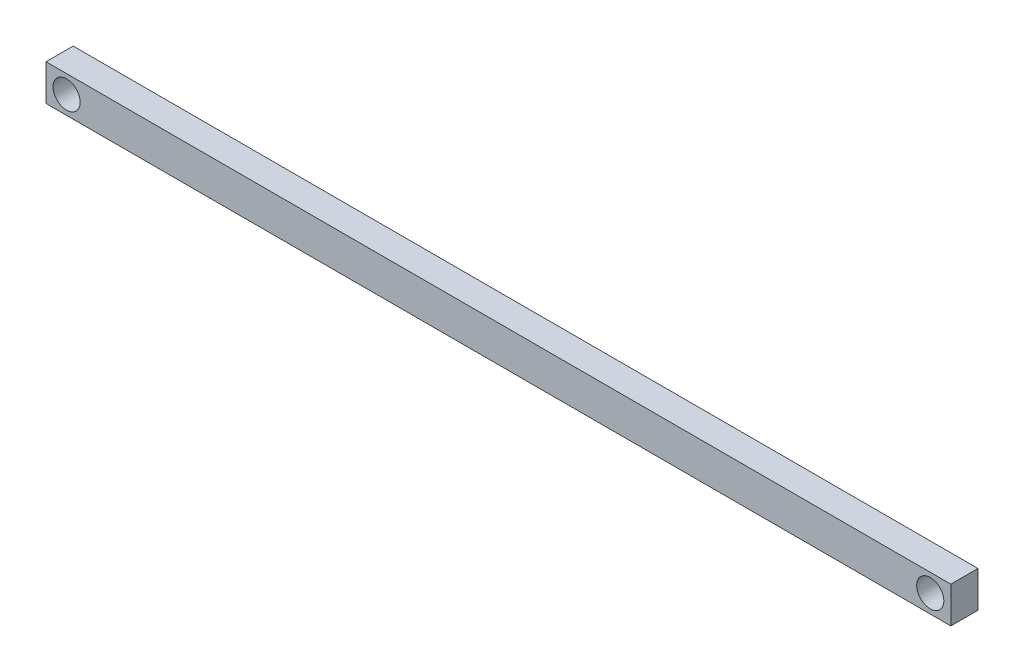
from build123d import *

# Parameters (mm, degrees)
SKETCH1_W           = 500
SKETCH1_H           = 20
SKETCH1_R           = 7.5
BOSS_EXTRUDE1_DEPTH = 15


with BuildPart() as part:
    # Sketch1 → Boss-Extrude1 (new body)
    with BuildSketch(Plane.XY):
        Rectangle(SKETCH1_W, SKETCH1_H)
        with Locations((-238.62, 0)):
            Circle(SKETCH1_R, mode=Mode.SUBTRACT)
        with Locations((238.62, 0)):
            Circle(SKETCH1_R, mode=Mode.SUBTRACT)
    extrude(amount=BOSS_EXTRUDE1_DEPTH)


solid = part.part
